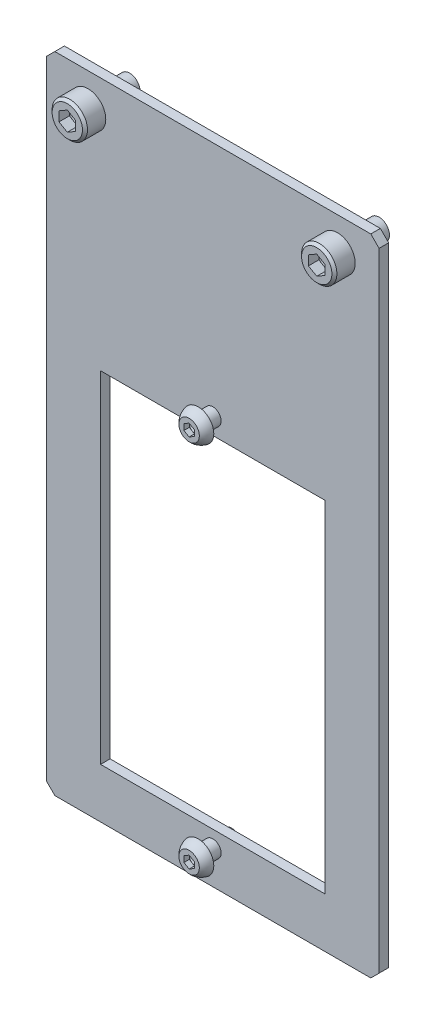
from build123d import *

# Parameters (mm, degrees)
SKETCH1_W                = 80
SKETCH1_H                = 155
BOSS_EXTRUDE1_DEPTH      = 2.3
SKETCH2_R                = 3.1
SKETCH2_W                = 54
SKETCH2_H                = 82
CUT_EXTRUDE1_DEPTH       = 153.362364119
CHAMFER1_SIZE            = 2
CUT_EXTRUDE2_DEPTH       = 2.5
CHAMFER2_SIZE            = 0.6
CHAMFER2_OF_MIRROR1_SIZE = 0.6
CUT_EXTRUDE3_DEPTH       = 1.3
LPATTERN1_COUNT          = 2
LPATTERN1_PITCH          = 90


with BuildPart() as part:
    # Sketch1 → Boss-Extrude1 (new body)
    with BuildSketch(Plane.XY):
        with Locations((0, -69.5)):
            Rectangle(SKETCH1_W, SKETCH1_H)
    extrude(amount=BOSS_EXTRUDE1_DEPTH)

    # Sketch2 → Cut-Extrude1 (cut, through all)
    with BuildSketch(Plane.XY.offset(2.3)):
        with Locations((-30, 0)):
            Circle(SKETCH2_R)
        with Locations((30, 0)):
            Circle(SKETCH2_R)
        with Locations((0, -94)):
            Rectangle(SKETCH2_W, SKETCH2_H)
    extrude(amount=-CUT_EXTRUDE1_DEPTH, mode=Mode.SUBTRACT)

    # Chamfer1
    chamfer1_edges = [part.edges().sort_by_distance(p)[0] for p in [
        (40, -147, 1.15),
        (40, 8, 1.15),
        (-40, 8, 1.15),
        (-40, -147, 1.15),
    ]]
    chamfer(chamfer1_edges, length=CHAMFER1_SIZE)

    # Sketch3 → Revolve1 (revolve)
    with BuildSketch(Plane(origin=(0, 0, 0), x_dir=(1, 0, 0), z_dir=(0, 1, 0))):
        Polygon((-28, -7.3), (-25.75, -7.3), (-25.75, -2.3), (-27.5, -2.3), (-27.5, 7.7), (-30, 7.7), (-30, -4.264101615), (-28, -4.8), align=None)
    revolve1 = revolve(axis=Axis((-30, 0, 7.3), (0, 0, -1)))

    # Sketch4 → Cut-Extrude2 (cut)
    with BuildSketch(Plane.XY.offset(7.3)):
        Polygon((-30, 2.309401077), (-32, 1.154700538), (-32, -1.154700538), (-30, -2.309401077), (-28, -1.154700538), (-28, 1.154700538), align=None)
    cut_extrude2 = extrude(amount=-CUT_EXTRUDE2_DEPTH, mode=Mode.SUBTRACT)

    # Chamfer2
    chamfer2_edges = [part.edges().sort_by_distance(p)[0] for p in [
        (-34.25, 0, 7.3),
    ]]
    chamfer(chamfer2_edges, length=CHAMFER2_SIZE)

    # Mirror1: Revolve1, Cut-Extrude2 across plane
    add(revolve1.mirror(Plane(origin=(0, 0, 0), x_dir=(0, 0, 1), z_dir=(1, 0, 0))))
    add(cut_extrude2.mirror(Plane(origin=(0, 0, 0), x_dir=(0, 0, 1), z_dir=(1, 0, 0))), mode=Mode.SUBTRACT)

    # Chamfer2 of Mirror1
    chamfer2_of_mirror1_edges = [part.edges().sort_by_distance(p)[0] for p in [
        (34.25, 0, 7.3),
    ]]
    chamfer(chamfer2_of_mirror1_edges, length=CHAMFER2_OF_MIRROR1_SIZE)

    # Sketch5 → Revolve2 (revolve)
    with BuildSketch(Plane(origin=(0, 0, 0), x_dir=(0, 0, -1), z_dir=(1, 0, 0)), mode=Mode.PRIVATE) as revolve2_sk:
        with BuildLine():
            Line((2.2, -47), (-5.8, -47))
            Line((-5.8, -47), (-5.8, -45.265030121))
            ThreePointArc((-5.8, -45.265030121), (-7.010286128, -45.715063637), (-8, -46.544394168))
            Line((-8, -46.544394168), (-8, -47.75))
            Line((-8, -47.75), (-6.7, -47.75))
            Line((-6.7, -47.75), (-5.978312164, -49))
            Line((-5.978312164, -49), (2.2, -49))
            Line((2.2, -49), (2.2, -47))
        make_face()
    revolve2 = revolve(revolve2_sk.sketch.rotate(Axis((0, -49, 8), (0, 0, -1)), 90), axis=Axis((0, -49, 8), (0, 0, -1)))

    # Sketch6 → Cut-Extrude3 (cut)
    with BuildSketch(Plane.XY.offset(8)):
        Polygon((0, -47.556624327), (-1.25, -48.278312164), (-1.25, -49.721687836), (0, -50.443375673), (1.25, -49.721687836), (1.25, -48.278312164), align=None)
    cut_extrude3 = extrude(amount=-CUT_EXTRUDE3_DEPTH, mode=Mode.SUBTRACT)

    # LPattern1: Revolve2, Cut-Extrude3 ×2
    with Locations(*[(0, -i * LPATTERN1_PITCH, 0) for i in range(1, LPATTERN1_COUNT)]):
        add(revolve2)
        add(cut_extrude3, mode=Mode.SUBTRACT)


solid = part.part
